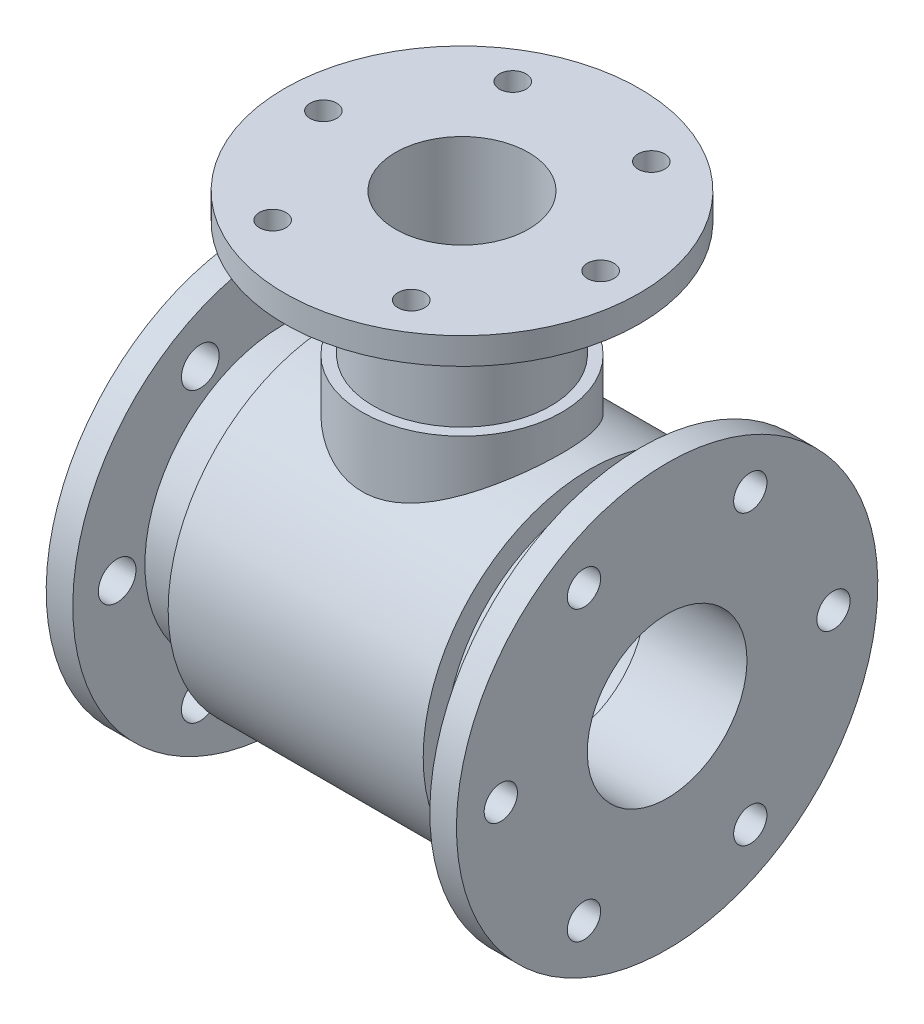
from build123d import *

# Parameters (mm, degrees)
BOSS_EXTRUDE7_REACH      = 217.595
BOSS_EXTRUDE7_END_RADIUS = 75
SKETCH7_R                = 45
CUT_EXTRUDE1_REACH       = 284.986
SKETCH15_R               = 30
CUT_EXTRUDE2_REACH       = 261.374
SKETCH16_R               = 7.5
CUT_EXTRUDE3_REACH       = 261.374
SKETCH21_R               = 8.5
CUT_EXTRUDE4_REACH       = 284.986
SKETCH25_R               = 6


with BuildPart() as part:
    # Sketch1 → Revolve1 (revolve)
    with BuildSketch(Plane.XY, mode=Mode.PRIVATE) as revolve1_sk:
        with BuildLine():
            Line((-92.5, -95), (-92.5, -52.5))
            Line((-92.5, -52.5), (-87.5, -52.5))
            Line((-87.5, -52.5), (-87.5, -47.5))
            Line((-87.5, -47.5), (-42.5, -47.5))
            Line((-42.5, -47.5), (-42.5, -50.5))
            ThreePointArc((-42.5, -50.5), (-41.914213562, -51.914213562), (-40.5, -52.5))
            Line((-40.5, -52.5), (27.5, -52.5))
            ThreePointArc((27.5, -52.5), (28.914213562, -51.914213562), (29.5, -50.5))
            Line((29.5, -50.5), (29.5, -43.5))
            Line((29.5, -43.5), (44.5, -43.5))
            Line((44.5, -43.5), (46.5, -41.5))
            Line((46.5, -41.5), (46.5, -36))
            Line((46.5, -36), (92.5, -36))
            Line((92.5, -36), (92.5, -95))
            Line((92.5, -95), (80.5, -95))
            Line((80.5, -95), (80.5, -50))
            Line((80.5, -50), (66.5, -50))
            Line((66.5, -50), (66.5, -65))
            Line((66.5, -65), (57.5, -65))
            Line((57.5, -65), (57.5, -75))
            Line((57.5, -75), (-57.5, -75))
            Line((-57.5, -75), (-57.5, -62.5))
            Line((-57.5, -62.5), (-80.5, -62.5))
            Line((-80.5, -62.5), (-80.5, -95))
            Line((-80.5, -95), (-92.5, -95))
        make_face()
    revolve(revolve1_sk.sketch.rotate(Axis((0, 0, 0), (-1, 0, 0)), 180), axis=Axis((0, 0, 0), (-1, 0, 0)))



with BuildPart() as body_2:
    # Sketch2 → Revolve2 (revolve)
    with BuildSketch(Plane.XY, mode=Mode.PRIVATE) as revolve2_sk:
        Polygon((0, 155), (80, 155), (80, 143), (40, 143), (40, 91), (45, 91), (45, 75), (0, 75), align=None)
    revolve(revolve2_sk.sketch.rotate(Axis((0, 155, 0), (0, -1, 0)), 180), axis=Axis((0, 155, 0), (0, -1, 0)))


with BuildPart() as part_1:
    add(part.part)

    add(body_2.part)  # Boss-Extrude7 merges body 2
    # Boss-Extrude7: up to this cylinder (the profile starts outside it)
    boss_extrude7_end = Plane(origin=(0, 0, 0), z_dir=(1, 0, 0)) * Cylinder(BOSS_EXTRUDE7_END_RADIUS, 586.19, mode=Mode.PRIVATE)
    # Sketch7 → Boss-Extrude7 (add, up to the surface)
    with BuildSketch(Plane.XZ.offset(-75), mode=Mode.PRIVATE) as boss_extrude7_sk1:
        with Locations(Location((0, 0, 0), (0, 0, 180))):
            Circle(SKETCH7_R)
    boss_extrude7_tool1 = extrude(boss_extrude7_sk1.sketch, amount=BOSS_EXTRUDE7_REACH, mode=Mode.PRIVATE) - boss_extrude7_end
    add(boss_extrude7_tool1.solids().sort_by_distance((0, 75, 0))[0])
    add(boss_extrude7_tool1.solids().sort_by_distance((0, 75, 0))[1])

    # Sketch15 → Cut-Extrude1 (cut, up to next)
    with BuildSketch(Plane(origin=(0, 155, 0), x_dir=(1, 0, 0), z_dir=(0, 1, 0)), mode=Mode.PRIVATE) as cut_extrude1_sk1:
        with Locations(Location((0, 0, 0), (0, 0, 180))):
            Circle(SKETCH15_R)
    cut_extrude1_tool1 = extrude(cut_extrude1_sk1.sketch, amount=-CUT_EXTRUDE1_REACH, mode=Mode.PRIVATE) & part_1.part
    add(cut_extrude1_tool1.solids().sort_by_distance((0, 155, 0))[0], mode=Mode.SUBTRACT)

    # Sketch16 → Cut-Extrude2 (cut, up to next)
    with BuildSketch(Plane(origin=(92.5, 0, 0), x_dir=(0, 0, -1), z_dir=(1, 0, 0)), mode=Mode.PRIVATE) as cut_extrude2_sk1:
        with Locations(Location((75, 0, 0), (0, 0, 90))):
            Circle(SKETCH16_R)
    cut_extrude2_tool1 = extrude(cut_extrude2_sk1.sketch, amount=-CUT_EXTRUDE2_REACH, mode=Mode.PRIVATE) & part_1.part
    # Sketch16 → Cut-Extrude2 (cut, up to next)
    with BuildSketch(Plane(origin=(92.5, 0, 0), x_dir=(0, 0, -1), z_dir=(1, 0, 0)), mode=Mode.PRIVATE) as cut_extrude2_sk2:
        with Locations(Location((37.5, -64.951905284, 0), (0, 0, 90))):
            Circle(SKETCH16_R)
    cut_extrude2_tool2 = extrude(cut_extrude2_sk2.sketch, amount=-CUT_EXTRUDE2_REACH, mode=Mode.PRIVATE) & part_1.part
    # Sketch16 → Cut-Extrude2 (cut, up to next)
    with BuildSketch(Plane(origin=(92.5, 0, 0), x_dir=(0, 0, -1), z_dir=(1, 0, 0)), mode=Mode.PRIVATE) as cut_extrude2_sk3:
        with Locations(Location((-37.5, -64.951905284, 0), (0, 0, 90))):
            Circle(SKETCH16_R)
    cut_extrude2_tool3 = extrude(cut_extrude2_sk3.sketch, amount=-CUT_EXTRUDE2_REACH, mode=Mode.PRIVATE) & part_1.part
    # Sketch16 → Cut-Extrude2 (cut, up to next)
    with BuildSketch(Plane(origin=(92.5, 0, 0), x_dir=(0, 0, -1), z_dir=(1, 0, 0)), mode=Mode.PRIVATE) as cut_extrude2_sk4:
        with Locations(Location((-75, 0, 0), (0, 0, 90))):
            Circle(SKETCH16_R)
    cut_extrude2_tool4 = extrude(cut_extrude2_sk4.sketch, amount=-CUT_EXTRUDE2_REACH, mode=Mode.PRIVATE) & part_1.part
    # Sketch16 → Cut-Extrude2 (cut, up to next)
    with BuildSketch(Plane(origin=(92.5, 0, 0), x_dir=(0, 0, -1), z_dir=(1, 0, 0)), mode=Mode.PRIVATE) as cut_extrude2_sk5:
        with Locations(Location((-37.5, 64.951905284, 0), (0, 0, 90))):
            Circle(SKETCH16_R)
    cut_extrude2_tool5 = extrude(cut_extrude2_sk5.sketch, amount=-CUT_EXTRUDE2_REACH, mode=Mode.PRIVATE) & part_1.part
    # Sketch16 → Cut-Extrude2 (cut, up to next)
    with BuildSketch(Plane(origin=(92.5, 0, 0), x_dir=(0, 0, -1), z_dir=(1, 0, 0)), mode=Mode.PRIVATE) as cut_extrude2_sk6:
        with Locations(Location((37.5, 64.951905284, 0), (0, 0, 90))):
            Circle(SKETCH16_R)
    cut_extrude2_tool6 = extrude(cut_extrude2_sk6.sketch, amount=-CUT_EXTRUDE2_REACH, mode=Mode.PRIVATE) & part_1.part
    add(cut_extrude2_tool1.solids().sort_by_distance((92.5, 0, -75))[0], mode=Mode.SUBTRACT)
    add(cut_extrude2_tool2.solids().sort_by_distance((92.5, -64.951905, -37.5))[0], mode=Mode.SUBTRACT)
    add(cut_extrude2_tool3.solids().sort_by_distance((92.5, -64.951905, 37.5))[0], mode=Mode.SUBTRACT)
    add(cut_extrude2_tool4.solids().sort_by_distance((92.5, 0, 75))[0], mode=Mode.SUBTRACT)
    add(cut_extrude2_tool5.solids().sort_by_distance((92.5, 64.951905, 37.5))[0], mode=Mode.SUBTRACT)
    add(cut_extrude2_tool6.solids().sort_by_distance((92.5, 64.951905, -37.5))[0], mode=Mode.SUBTRACT)

    # Sketch21 → Cut-Extrude3 (cut, up to next)
    with BuildSketch(Plane.ZY.offset(92.5), mode=Mode.PRIVATE) as cut_extrude3_sk1:
        with Locations(Location((75, 0, 0), (0, 0, 270))):
            Circle(SKETCH21_R)
    cut_extrude3_tool1 = extrude(cut_extrude3_sk1.sketch, amount=-CUT_EXTRUDE3_REACH, mode=Mode.PRIVATE) & part_1.part
    # Sketch21 → Cut-Extrude3 (cut, up to next)
    with BuildSketch(Plane.ZY.offset(92.5), mode=Mode.PRIVATE) as cut_extrude3_sk2:
        with Locations(Location((37.5, -64.951905284, 0), (0, 0, 270))):
            Circle(SKETCH21_R)
    cut_extrude3_tool2 = extrude(cut_extrude3_sk2.sketch, amount=-CUT_EXTRUDE3_REACH, mode=Mode.PRIVATE) & part_1.part
    # Sketch21 → Cut-Extrude3 (cut, up to next)
    with BuildSketch(Plane.ZY.offset(92.5), mode=Mode.PRIVATE) as cut_extrude3_sk3:
        with Locations(Location((-37.5, -64.951905284, 0), (0, 0, 270))):
            Circle(SKETCH21_R)
    cut_extrude3_tool3 = extrude(cut_extrude3_sk3.sketch, amount=-CUT_EXTRUDE3_REACH, mode=Mode.PRIVATE) & part_1.part
    # Sketch21 → Cut-Extrude3 (cut, up to next)
    with BuildSketch(Plane.ZY.offset(92.5), mode=Mode.PRIVATE) as cut_extrude3_sk4:
        with Locations(Location((-75, 0, 0), (0, 0, 270))):
            Circle(SKETCH21_R)
    cut_extrude3_tool4 = extrude(cut_extrude3_sk4.sketch, amount=-CUT_EXTRUDE3_REACH, mode=Mode.PRIVATE) & part_1.part
    # Sketch21 → Cut-Extrude3 (cut, up to next)
    with BuildSketch(Plane.ZY.offset(92.5), mode=Mode.PRIVATE) as cut_extrude3_sk5:
        with Locations(Location((-37.5, 64.951905284, 0), (0, 0, 270))):
            Circle(SKETCH21_R)
    cut_extrude3_tool5 = extrude(cut_extrude3_sk5.sketch, amount=-CUT_EXTRUDE3_REACH, mode=Mode.PRIVATE) & part_1.part
    # Sketch21 → Cut-Extrude3 (cut, up to next)
    with BuildSketch(Plane.ZY.offset(92.5), mode=Mode.PRIVATE) as cut_extrude3_sk6:
        with Locations(Location((37.5, 64.951905284, 0), (0, 0, 270))):
            Circle(SKETCH21_R)
    cut_extrude3_tool6 = extrude(cut_extrude3_sk6.sketch, amount=-CUT_EXTRUDE3_REACH, mode=Mode.PRIVATE) & part_1.part
    add(cut_extrude3_tool1.solids().sort_by_distance((-92.5, 0, 75))[0], mode=Mode.SUBTRACT)
    add(cut_extrude3_tool2.solids().sort_by_distance((-92.5, -64.951905, 37.5))[0], mode=Mode.SUBTRACT)
    add(cut_extrude3_tool3.solids().sort_by_distance((-92.5, -64.951905, -37.5))[0], mode=Mode.SUBTRACT)
    add(cut_extrude3_tool4.solids().sort_by_distance((-92.5, 0, -75))[0], mode=Mode.SUBTRACT)
    add(cut_extrude3_tool5.solids().sort_by_distance((-92.5, 64.951905, -37.5))[0], mode=Mode.SUBTRACT)
    add(cut_extrude3_tool6.solids().sort_by_distance((-92.5, 64.951905, 37.5))[0], mode=Mode.SUBTRACT)

    # Sketch25 → Cut-Extrude4 (cut, up to next)
    with BuildSketch(Plane(origin=(0, 155, 0), x_dir=(1, 0, 0), z_dir=(0, 1, 0)), mode=Mode.PRIVATE) as cut_extrude4_sk1:
        with Locations(Location((62.5, 0, 0), (0, 0, 180))):
            Circle(SKETCH25_R)
    cut_extrude4_tool1 = extrude(cut_extrude4_sk1.sketch, amount=-CUT_EXTRUDE4_REACH, mode=Mode.PRIVATE) & part_1.part
    # Sketch25 → Cut-Extrude4 (cut, up to next)
    with BuildSketch(Plane(origin=(0, 155, 0), x_dir=(1, 0, 0), z_dir=(0, 1, 0)), mode=Mode.PRIVATE) as cut_extrude4_sk2:
        with Locations(Location((31.25, -54.126587737, 0), (0, 0, 180))):
            Circle(SKETCH25_R)
    cut_extrude4_tool2 = extrude(cut_extrude4_sk2.sketch, amount=-CUT_EXTRUDE4_REACH, mode=Mode.PRIVATE) & part_1.part
    # Sketch25 → Cut-Extrude4 (cut, up to next)
    with BuildSketch(Plane(origin=(0, 155, 0), x_dir=(1, 0, 0), z_dir=(0, 1, 0)), mode=Mode.PRIVATE) as cut_extrude4_sk3:
        with Locations(Location((-31.25, -54.126587737, 0), (0, 0, 180))):
            Circle(SKETCH25_R)
    cut_extrude4_tool3 = extrude(cut_extrude4_sk3.sketch, amount=-CUT_EXTRUDE4_REACH, mode=Mode.PRIVATE) & part_1.part
    # Sketch25 → Cut-Extrude4 (cut, up to next)
    with BuildSketch(Plane(origin=(0, 155, 0), x_dir=(1, 0, 0), z_dir=(0, 1, 0)), mode=Mode.PRIVATE) as cut_extrude4_sk4:
        with Locations(Location((-62.5, 0, 0), (0, 0, 180))):
            Circle(SKETCH25_R)
    cut_extrude4_tool4 = extrude(cut_extrude4_sk4.sketch, amount=-CUT_EXTRUDE4_REACH, mode=Mode.PRIVATE) & part_1.part
    # Sketch25 → Cut-Extrude4 (cut, up to next)
    with BuildSketch(Plane(origin=(0, 155, 0), x_dir=(1, 0, 0), z_dir=(0, 1, 0)), mode=Mode.PRIVATE) as cut_extrude4_sk5:
        with Locations(Location((-31.25, 54.126587737, 0), (0, 0, 180))):
            Circle(SKETCH25_R)
    cut_extrude4_tool5 = extrude(cut_extrude4_sk5.sketch, amount=-CUT_EXTRUDE4_REACH, mode=Mode.PRIVATE) & part_1.part
    # Sketch25 → Cut-Extrude4 (cut, up to next)
    with BuildSketch(Plane(origin=(0, 155, 0), x_dir=(1, 0, 0), z_dir=(0, 1, 0)), mode=Mode.PRIVATE) as cut_extrude4_sk6:
        with Locations(Location((31.25, 54.126587737, 0), (0, 0, 180))):
            Circle(SKETCH25_R)
    cut_extrude4_tool6 = extrude(cut_extrude4_sk6.sketch, amount=-CUT_EXTRUDE4_REACH, mode=Mode.PRIVATE) & part_1.part
    add(cut_extrude4_tool1.solids().sort_by_distance((62.5, 155, 0))[0], mode=Mode.SUBTRACT)
    add(cut_extrude4_tool2.solids().sort_by_distance((31.25, 155, 54.126588))[0], mode=Mode.SUBTRACT)
    add(cut_extrude4_tool3.solids().sort_by_distance((-31.25, 155, 54.126588))[0], mode=Mode.SUBTRACT)
    add(cut_extrude4_tool4.solids().sort_by_distance((-62.5, 155, 0))[0], mode=Mode.SUBTRACT)
    add(cut_extrude4_tool5.solids().sort_by_distance((-31.25, 155, -54.126588))[0], mode=Mode.SUBTRACT)
    add(cut_extrude4_tool6.solids().sort_by_distance((31.25, 155, -54.126588))[0], mode=Mode.SUBTRACT)


solid = part_1.part
